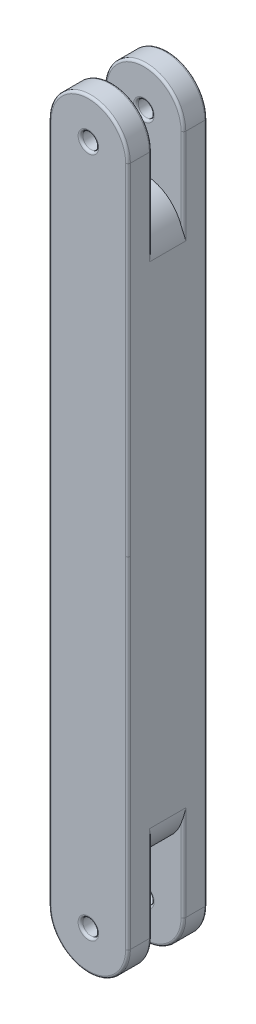
from build123d import *

# Parameters (mm, degrees)
SKETCH1_W                   = 63.5
SKETCH1_H                   = 63.5
BOSS_EXTRUDE1_DEPTH         = 304.8
FILLET1_RADIUS              = 31.75
FILLET1_LENGTH              = 63.5
SKETCH2_W                   = 25.4
SKETCH2_H                   = 76.2
CUT_EXTRUDE1_DEPTH          = 31.75
HOLE1_D                     = 12.7
HOLE1_DEPTH                 = 19.051
FILLET2_RADIUS              = 31.75
FILLET2_LENGTH              = 25.4
FILLET3_R                   = 1.905
MIRROR7_COPY_1_D            = 12.7
MIRROR7_COPY_1_DEPTH        = 19.051
FILLET1_OF_MIRROR7_2_RADIUS = 31.75
FILLET1_OF_MIRROR7_2_LENGTH = 63.5
FILLET2_OF_MIRROR7_2_RADIUS = 31.75
FILLET2_OF_MIRROR7_2_LENGTH = 25.4
FILLET3_OF_MIRROR7_R        = 1.905


with BuildPart() as part:
    # Sketch1 → Boss-Extrude1 (new body)
    with BuildSketch(Plane(origin=(0, 0, 0), x_dir=(1, 0, 0), z_dir=(0, 1, 0))):
        Rectangle(SKETCH1_W, SKETCH1_H)
    boss_extrude1 = extrude(amount=BOSS_EXTRUDE1_DEPTH)

    # Fillet1: full round fillet: the end face becomes a half cylinder, R = half its width
    fillet1_face = Plane((0, 0, 0), x_dir=(0, 0, -1), z_dir=(0, -1, 0))  # on the end face: x along it, z out of the body
    fillet1_slab = fillet1_face.offset(-FILLET1_RADIUS / 2) * Box(FILLET1_LENGTH, 2 * FILLET1_RADIUS, FILLET1_RADIUS, mode=Mode.PRIVATE)  # the body's end, R deep
    fillet1_round = Plane((0, 31.75, 0), x_dir=(0, -1, 0), z_dir=(0, 0, -1)) * Cylinder(FILLET1_RADIUS, FILLET1_LENGTH, mode=Mode.PRIVATE)  # its axis R under the face
    add(fillet1_slab - fillet1_round, mode=Mode.SUBTRACT)

    # Sketch2 → Cut-Extrude1 (cut, symmetric)
    with BuildSketch(Plane(origin=(0, 0, 0), x_dir=(0, 0, -1), z_dir=(1, 0, 0))):
        with Locations((0, 38.1)):
            Rectangle(SKETCH2_W, SKETCH2_H)
    cut_extrude1 = extrude(amount=CUT_EXTRUDE1_DEPTH, both=True, mode=Mode.SUBTRACT)

    # Hole1
    with Locations(Plane.XY.offset(31.75)):
        with Locations((0, 31.75)):
            hole1 = Hole(HOLE1_D / 2, depth=HOLE1_DEPTH)

    # Mirror1: Hole1 across plane
    add(hole1.mirror(Plane.XY), mode=Mode.SUBTRACT)

    # Fillet2: full round fillet: the end face becomes a half cylinder, R = half its width
    fillet2_face = Plane((0, 76.2, 0), x_dir=(0, 0, -1), z_dir=(0, -1, 0))  # on the end face: x along it, z out of the body
    fillet2_slab = fillet2_face.offset(-FILLET2_RADIUS / 2) * Box(FILLET2_LENGTH, 2 * FILLET2_RADIUS, FILLET2_RADIUS, mode=Mode.PRIVATE)  # the body's end, R deep
    fillet2_round = Plane((0, 107.95, 0), x_dir=(0, -1, 0), z_dir=(0, 0, -1)) * Cylinder(FILLET2_RADIUS, FILLET2_LENGTH, mode=Mode.PRIVATE)  # its axis R under the face
    add(fillet2_slab - fillet2_round, mode=Mode.SUBTRACT)

    # Fillet3
    fillet3_edges = [part.edges().sort_by_distance(p)[0] for p in [
        (0, 0, -31.75),
        (0, 0, 31.75),
        (-31.75, 69.85, -12.7),
        (0, 0, 12.7),
        (0, 0, -12.7),
        (-31.75, 69.85, 12.7),
        (31.75, 69.85, 12.7),
        (31.75, 69.85, -12.7),
        (6.35, 31.75, 31.75),
        (6.35, 31.75, 12.7),
        (6.35, 31.75, -31.75),
        (6.35, 31.75, -12.7),
        (31.75, 168.275, 31.75),
        (-31.75, 168.275, 31.75),
        (-31.75, 168.275, -31.75),
        (31.75, 168.275, -31.75),
    ]]
    fillet(fillet3_edges, radius=FILLET3_R)

    # Mirror7: Boss-Extrude1, Cut-Extrude1, Hole1 across plane
    add(boss_extrude1.mirror(Plane(origin=(0, 304.8, 0), x_dir=(0, 0, 1), z_dir=(0, -1, 0))))
    add(cut_extrude1.mirror(Plane(origin=(0, 304.8, 0), x_dir=(0, 0, 1), z_dir=(0, -1, 0))), mode=Mode.SUBTRACT)
    add(hole1.mirror(Plane(origin=(0, 304.8, 0), x_dir=(0, 0, 1), z_dir=(0, -1, 0))), mode=Mode.SUBTRACT)

    # Mirror7 copy 1
    with Locations(Plane(origin=(0, 609.6, -31.75), x_dir=(1, 0, 0), z_dir=(0, 0, -1))):
        with Locations((0, 31.75)):
            Hole(MIRROR7_COPY_1_D / 2, depth=MIRROR7_COPY_1_DEPTH)

    # Fillet1 of Mirror7 2: full round fillet: the end face becomes a half cylinder, R = half its width
    fillet1_of_mirror7_2_face = Plane((0, 609.6, 0), x_dir=(0, 0, -1), z_dir=(0, 1, 0))  # on the end face: x along it, z out of the body
    fillet1_of_mirror7_2_slab = fillet1_of_mirror7_2_face.offset(-FILLET1_OF_MIRROR7_2_RADIUS / 2) * Box(FILLET1_OF_MIRROR7_2_LENGTH, 2 * FILLET1_OF_MIRROR7_2_RADIUS, FILLET1_OF_MIRROR7_2_RADIUS, mode=Mode.PRIVATE)  # the body's end, R deep
    fillet1_of_mirror7_2_round = Plane((0, 577.85, 0), x_dir=(0, 1, 0), z_dir=(0, 0, -1)) * Cylinder(FILLET1_OF_MIRROR7_2_RADIUS, FILLET1_OF_MIRROR7_2_LENGTH, mode=Mode.PRIVATE)  # its axis R under the face
    add(fillet1_of_mirror7_2_slab - fillet1_of_mirror7_2_round, mode=Mode.SUBTRACT)

    # Fillet2 of Mirror7 2: full round fillet: the end face becomes a half cylinder, R = half its width
    fillet2_of_mirror7_2_face = Plane((0, 533.4, 0), x_dir=(0, 0, -1), z_dir=(0, 1, 0))  # on the end face: x along it, z out of the body
    fillet2_of_mirror7_2_slab = fillet2_of_mirror7_2_face.offset(-FILLET2_OF_MIRROR7_2_RADIUS / 2) * Box(FILLET2_OF_MIRROR7_2_LENGTH, 2 * FILLET2_OF_MIRROR7_2_RADIUS, FILLET2_OF_MIRROR7_2_RADIUS, mode=Mode.PRIVATE)  # the body's end, R deep
    fillet2_of_mirror7_2_round = Plane((0, 501.65, 0), x_dir=(0, 1, 0), z_dir=(0, 0, -1)) * Cylinder(FILLET2_OF_MIRROR7_2_RADIUS, FILLET2_OF_MIRROR7_2_LENGTH, mode=Mode.PRIVATE)  # its axis R under the face
    add(fillet2_of_mirror7_2_slab - fillet2_of_mirror7_2_round, mode=Mode.SUBTRACT)

    # Fillet3 of Mirror7
    fillet3_of_mirror7_edges = [part.edges().sort_by_distance(p)[0] for p in [
        (0, 609.6, -31.75),
        (0, 609.6, 31.75),
        (-31.75, 539.75, -12.7),
        (0, 609.6, 12.7),
        (0, 609.6, -12.7),
        (-31.75, 539.75, 12.7),
        (31.75, 539.75, 12.7),
        (31.75, 539.75, -12.7),
        (6.35, 577.85, 31.75),
        (6.35, 577.85, 12.7),
        (6.35, 577.85, -31.75),
        (6.35, 577.85, -12.7),
        (31.75, 441.325, 31.75),
        (-31.75, 441.325, 31.75),
        (-31.75, 441.325, -31.75),
        (31.75, 441.325, -31.75),
    ]]
    fillet(fillet3_of_mirror7_edges, radius=FILLET3_OF_MIRROR7_R)


solid = part.part
